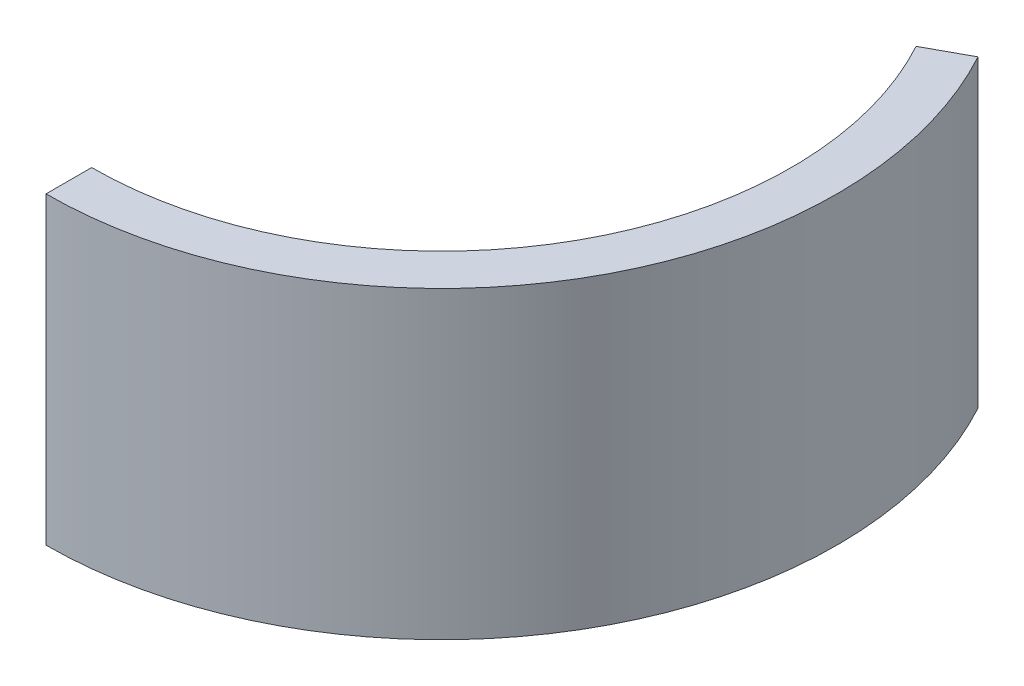
from build123d import *

# Parameters (mm, degrees)
EXTRUDE_1_DEPTH = 20


with BuildPart() as part:
    # 草图1 → 凸台-拉伸1 (new body)
    with BuildSketch(Plane(origin=(0, 0, 0), x_dir=(1, 0, 0), z_dir=(0, 1, 0))):
        with BuildLine():
            Line((0, -23), (0, -26))
            ThreePointArc((0, -26), (22.352900794, -13.27960188), (22.833663339, 12.434782609))
            Line((22.833663339, 12.434782609), (20.199009877, 11))
            ThreePointArc((20.199009877, 11), (19.773719933, -11.747340124), (0, -23))
        make_face()
    extrude(amount=EXTRUDE_1_DEPTH)


solid = part.part
